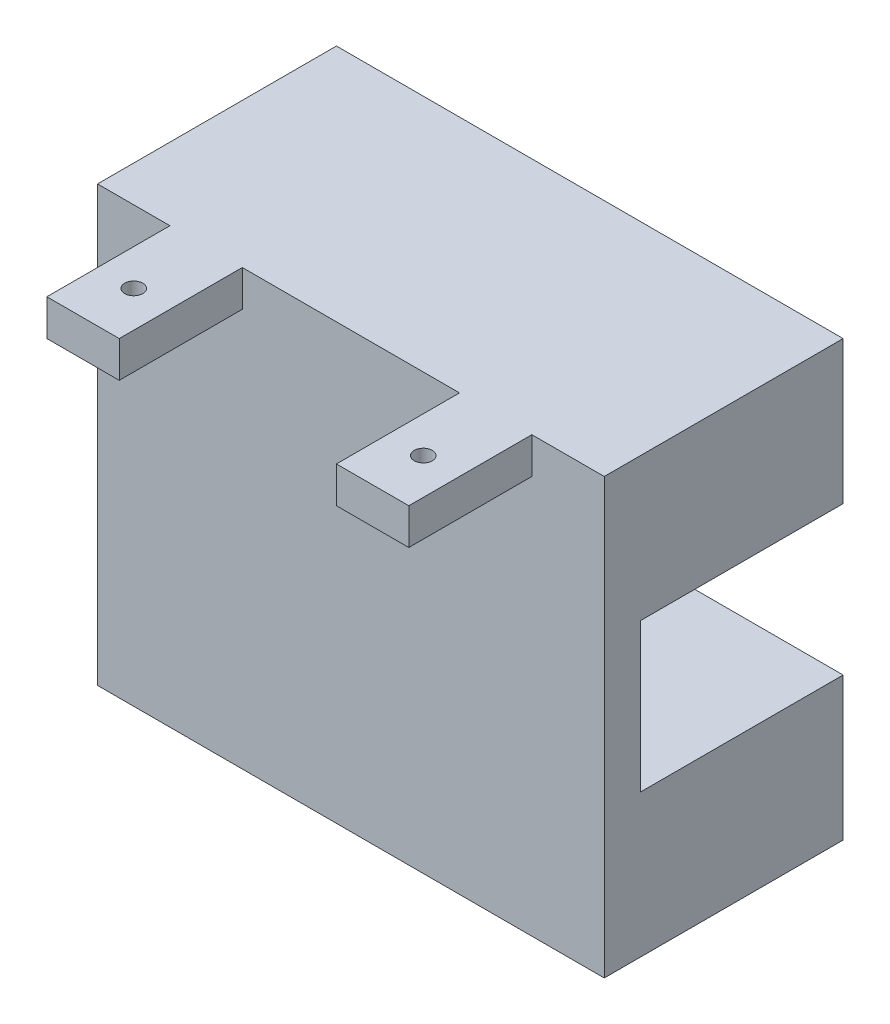
from build123d import *

# Parameters (mm, degrees)
SKETCH_2_W          = 70
SKETCH_2_H          = 60
EXTRUDE_2_DEPTH     = 33
SKETCH_3_W          = 40.7
SKETCH_3_H          = 20.5
CUT_EXTRUDE_1_DEPTH = 28
SKETCH_4_W          = 14.65
SKETCH_4_H          = 20.5
EXTRUDE_3_DEPTH     = 28
SKETCH_5_W          = 14.65
SKETCH_5_H          = 20.5
CUT_EXTRUDE_4_DEPTH = 28
SKETCH_8_W          = 10
SKETCH_8_H          = 5
EXTRUDE_5_DEPTH     = 50
M3X0_5_1_D          = 2.5


with BuildPart() as part:
    # ｽｹｯﾁ2 → ﾎﾞｽ - 押し出し2 (new body)
    with BuildSketch(Plane.XY):
        Rectangle(SKETCH_2_W, SKETCH_2_H)
    extrude(amount=EXTRUDE_2_DEPTH)

    # ｽｹｯﾁ3 → ｶｯﾄ - 押し出し1 (cut)
    with BuildSketch(Plane.XY):
        Rectangle(SKETCH_3_W, SKETCH_3_H)
    extrude(amount=CUT_EXTRUDE_1_DEPTH, mode=Mode.SUBTRACT)

    # ｽｹｯﾁ4 → ﾎﾞｽ - 押し出し3 (add)
    with BuildSketch(Plane.XY):
        with Locations((27.675, 0)):
            Rectangle(SKETCH_4_W, SKETCH_4_H)
    extrude(amount=EXTRUDE_3_DEPTH)

    # ｽｹｯﾁ5 → ｶｯﾄ - 押し出し4 (cut)
    with BuildSketch(Plane.XY):
        with Locations((27.675, 0)):
            Rectangle(SKETCH_5_W, SKETCH_5_H)
    extrude(amount=CUT_EXTRUDE_4_DEPTH, mode=Mode.SUBTRACT)

    # ｽｹｯﾁ8 → ﾎﾞｽ - 押し出し5 (add)
    with BuildSketch(Plane.XY):
        with Locations((-20, 27.5)):
            Rectangle(SKETCH_8_W, SKETCH_8_H)
        with Locations((20, 27.5)):
            Rectangle(SKETCH_8_W, SKETCH_8_H)
    extrude(amount=EXTRUDE_5_DEPTH)

    # M3x0.5 ねじ穴1 (through all)
    with Locations(Plane(origin=(0, 30, 0), x_dir=(1, 0, 0), z_dir=(0, 1, 0))):
        with Locations((-20, -43), (20, -43)):
            Hole(M3X0_5_1_D / 2)


solid = part.part
